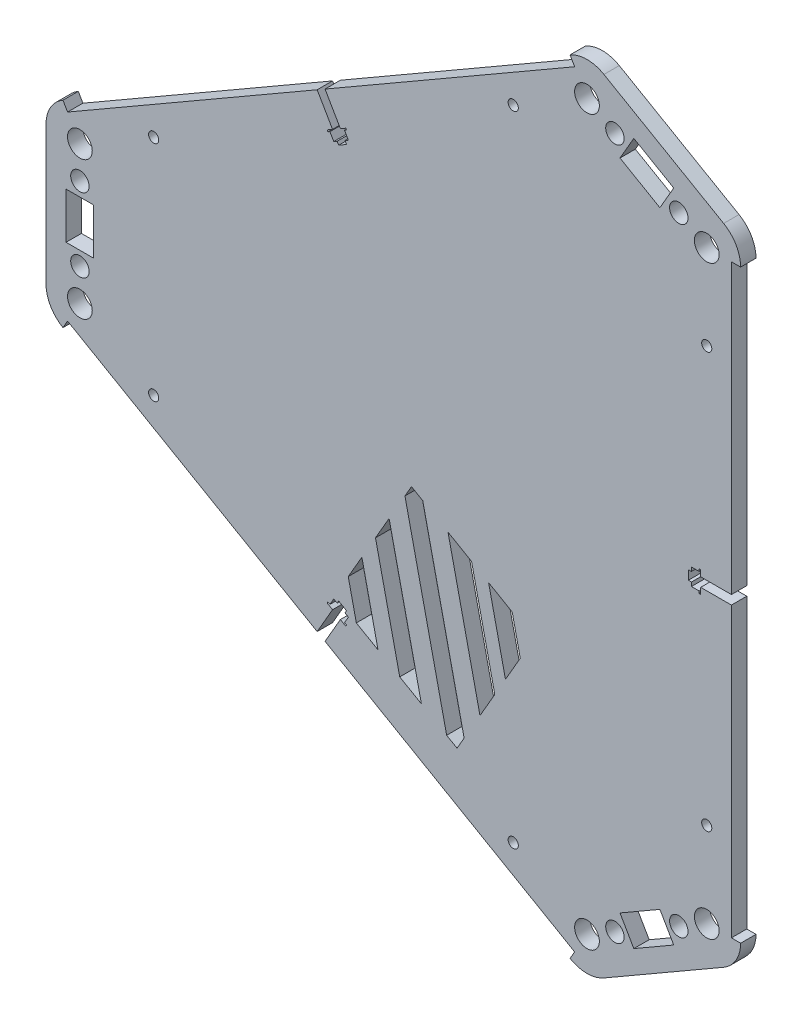
from build123d import *

# Parameters (mm, degrees)
SKETCH1_R           = 4.025
SKETCH1_R_2         = 1.65
SKETCH1_R_3         = 3
SKETCH1_W           = 9
SKETCH1_H           = 15
BOSS_EXTRUDE1_DEPTH = 5
CUT_EXTRUDE1_DEPTH  = 186.946611569
CUT_EXTRUDE2_DEPTH  = 186.946611569


with BuildPart() as part:
    # Sketch1 → Boss-Extrude1 (new body)
    with BuildSketch(Plane.XY):
        with BuildLine():
            Line((-127.0125, 29.449853865), (38.001928415, 124.720978531))
            Line((38.001928415, 124.720978531), (36.501928415, 127.319054742))
            ThreePointArc((36.501928415, 127.319054742), (42.014428415, 128.796124665), (47.526928415, 127.319054742))
            Line((47.526928415, 127.319054742), (86.498071585, 104.819054742))
            ThreePointArc((86.498071585, 104.819054742), (90.533501662, 100.783624665), (92.010571585, 95.271124665))
            Line((92.010571585, 95.271124665), (89.010571585, 95.271124665))
            Line((89.010571585, 95.271124665), (89.010571585, -95.271124665))
            Line((89.010571585, -95.271124665), (92.010571585, -95.271124665))
            ThreePointArc((92.010571585, -95.271124665), (90.533501662, -100.783624665), (86.498071585, -104.819054742))
            Line((86.498071585, -104.819054742), (47.526928415, -127.319054742))
            ThreePointArc((47.526928415, -127.319054742), (42.014427779, -128.796124665), (36.501927313, -127.319054106))
            Line((36.501927313, -127.319054106), (38.001927613, -124.720978068))
            Line((38.001927613, -124.720978068), (-127.012489808, -29.44983436))
            Line((-127.012489808, -29.44983436), (-128.512501102, -32.047929441))
            ThreePointArc((-128.512501102, -32.047929441), (-132.547930395, -28.012499449), (-134.025, -22.5))
            Line((-134.025, -22.5), (-134.025, 22.5))
            ThreePointArc((-134.025, 22.5), (-132.547930077, 28.0125), (-128.5125, 32.047930077))
            Line((-128.5125, 32.047930077), (-127.0125, 29.449853865))
        make_face()
        with Locations((-123, 22.5)):
            Circle(SKETCH1_R, mode=Mode.SUBTRACT)
        with Locations((-123, -22.5)):
            Circle(SKETCH1_R, mode=Mode.SUBTRACT)
        with Locations((42.014428415, 117.771124665)):
            Circle(SKETCH1_R, mode=Mode.SUBTRACT)
        with Locations((80.985571585, 95.271124665)):
            Circle(SKETCH1_R, mode=Mode.SUBTRACT)
        with Locations((80.985571585, -95.271124665)):
            Circle(SKETCH1_R, mode=Mode.SUBTRACT)
        with Locations((42.014428415, -117.771124665)):
            Circle(SKETCH1_R, mode=Mode.SUBTRACT)
        with Locations((-99, 36.356406461)):
            Circle(SKETCH1_R_2, mode=Mode.SUBTRACT)
        with Locations((-99, -36.356410153)):
            Circle(SKETCH1_R_2, mode=Mode.SUBTRACT)
        with Locations((80.985571585, 67.558311744)):
            Circle(SKETCH1_R_2, mode=Mode.SUBTRACT)
        with Locations((18.014425217, 103.914720051)):
            Circle(SKETCH1_R_2, mode=Mode.SUBTRACT)
        with Locations((18.014428415, -103.914718205)):
            Circle(SKETCH1_R_2, mode=Mode.SUBTRACT)
        with Locations((80.985574783, -67.558309898)):
            Circle(SKETCH1_R_2, mode=Mode.SUBTRACT)
        with Locations((-123, 12)):
            Circle(SKETCH1_R_3, mode=Mode.SUBTRACT)
        with Locations((-123, -12)):
            Circle(SKETCH1_R_3, mode=Mode.SUBTRACT)
        with Locations((71.892304845, 100.521124665)):
            Circle(SKETCH1_R_3, mode=Mode.SUBTRACT)
        with Locations((51.107695155, 112.521124665)):
            Circle(SKETCH1_R_3, mode=Mode.SUBTRACT)
        with Locations((51.107695155, -112.521124665)):
            Circle(SKETCH1_R_3, mode=Mode.SUBTRACT)
        with Locations((71.892304845, -100.521124665)):
            Circle(SKETCH1_R_3, mode=Mode.SUBTRACT)
        Polygon((57.254809472, -114.168238983), (70.245190528, -106.668238983), (65.745190528, -98.874010348), (52.754809472, -106.374010348), align=None, mode=Mode.SUBTRACT)
        with Locations((-123, 0)):
            Rectangle(SKETCH1_W, SKETCH1_H, mode=Mode.SUBTRACT)
        Polygon((65.745190528, 98.874010348), (52.754809472, 106.374010348), (57.254809472, 114.168238983), (70.245190528, 106.668238983), align=None, mode=Mode.SUBTRACT)
    extrude(amount=BOSS_EXTRUDE1_DEPTH)

    # Sketch2 → Cut-Extrude1 (cut, through all)
    with BuildSketch(Plane.XY.offset(5)):
        Polygon((89.010571585, 1.48), (79.010571585, 1.48), (79.010571585, 3.5), (78.510571585, 3.5), (78.510571585, 2.75), (76.010571585, 2.75), (76.010571585, 1.48), (75.010571585, 1.48), (75.010571585, -1.48), (76.010571585, -1.48), (76.010571585, -2.75), (78.510571585, -2.75), (78.510571585, -3.5), (79.010571585, -3.5), (79.010571585, -1.48), (89.010571585, -1.48), align=None)
        Polygon((-43.223568195, -77.825416198), (-38.223568195, -69.16516216), (-36.474196879, -70.17516216), (-36.224196879, -69.742149458), (-36.873715932, -69.367149458), (-35.623715932, -67.202085949), (-36.723568195, -66.567085949), (-36.223568195, -65.701060545), (-38.78700339, -64.221060545), (-39.28700339, -65.087085949), (-40.386855653, -64.452085949), (-41.636855653, -66.617149458), (-42.286374706, -66.242149458), (-42.536374706, -66.67516216), (-40.78700339, -67.68516216), (-45.78700339, -76.345416198), align=None)
        Polygon((-45.78700339, 76.345416198), (-40.78700339, 67.68516216), (-42.536374706, 66.67516216), (-42.286374706, 66.242149458), (-41.636855653, 66.617149458), (-40.386855653, 64.452085949), (-39.28700339, 65.087085949), (-38.78700339, 64.221060545), (-36.223568195, 65.701060545), (-36.723568195, 66.567085949), (-35.623715932, 67.202085949), (-36.873715932, 69.367149458), (-36.224196879, 69.742149458), (-36.474196879, 70.17516216), (-38.223568195, 69.16516216), (-43.223568195, 77.825416198), align=None)
    extrude(amount=-CUT_EXTRUDE1_DEPTH, mode=Mode.SUBTRACT)

    # Sketch3 → Cut-Extrude2 (cut, through all)
    with BuildSketch(Plane.XY.offset(5)):
        Polygon((-35.672418314, -55.786425681), (-33.042712773, -67.537516271), (-25.982061715, -71.613986146), (-31.241472797, -48.111804967), align=None)
        Polygon((-26.810527281, -40.437184252), (-18.921410657, -75.690456022), (-11.8607596, -79.766925897), (-22.379581764, -32.762563537), align=None)
        Polygon((-17.226520227, -23.837201518), (-3.649426542, -84.507742511), (-0.26619791, -86.461050993), (2.041586213, -82.463852704), (-11.425936407, -22.282940485), (-15.103358833, -20.159779092), align=None)
        Polygon((-3.21460335, -27.0237571), (7.194647751, -73.538490685), (12.010892877, -65.196511647), (4.460017365, -31.454702616), align=None)
        Polygon((9.998535314, -34.652368297), (15.486616444, -59.176383442), (20.30286157, -50.834404404), (17.673156029, -39.083313814), align=None)
    extrude(amount=-CUT_EXTRUDE2_DEPTH, mode=Mode.SUBTRACT)


solid = part.part
